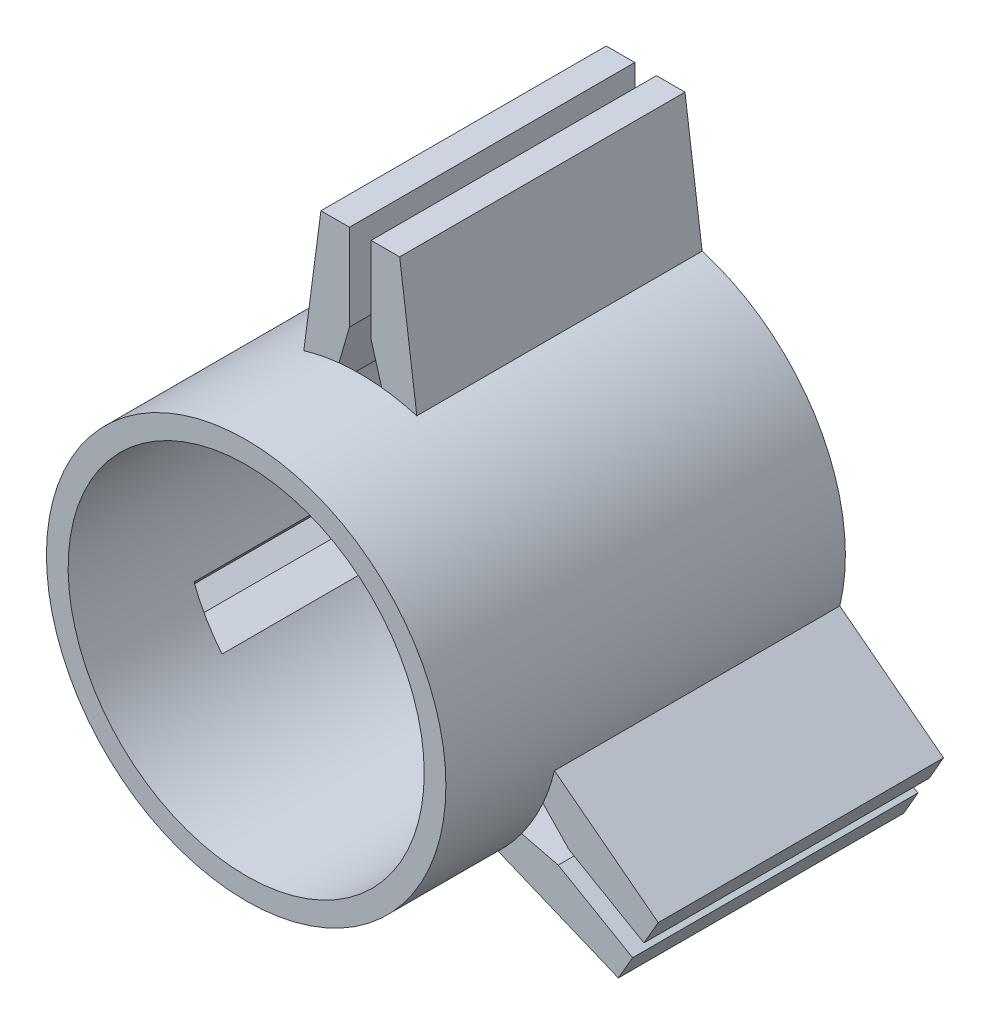
from build123d import *
from build123d.topology import SkipClean

# Parameters (mm, degrees)
SKETCH1_R           = 44.45
SKETCH1_R_2         = 39.624
BOSS_EXTRUDE1_DEPTH = 25.4
BOSS_EXTRUDE2_START = 63.5
SKETCH2_R           = 39.624
BOSS_EXTRUDE2_DEPTH = 63.5
CUT_EXTRUDE1_DEPTH  = 63.5
BOSS_EXTRUDE3_DEPTH = 63.5


with BuildPart() as part:
    # Sketch1 → Boss-Extrude1 (new body)
    with BuildSketch(Plane.XY):
        Circle(SKETCH1_R)
        Circle(SKETCH1_R_2, mode=Mode.SUBTRACT)
    extrude(amount=BOSS_EXTRUDE1_DEPTH)

    # Sketch2 → Boss-Extrude2 (add)
    with SkipClean():  # the faces are left unmerged after this step: merging them gives an invalid solid
        with BuildSketch(Plane(origin=(0, 0, 0), x_dir=(-1, 0, 0), z_dir=(0, 0, -1)).offset(BOSS_EXTRUDE2_START)):
            with BuildLine():
                ThreePointArc((37.231566396, -24.28194728), (38.494829198, -22.225), (39.644566396, -20.102508681))
                Line((39.644566396, -20.102508681), (63.01819717, -33.597280701))
                Line((63.01819717, -33.597280701), (66.19319717, -28.098019387))
                Line((66.19319717, -28.098019387), (42.120859404, -14.199848698))
                ThreePointArc((42.120859404, -14.199848698), (38.494829198, 22.225), (8.763, 43.577658622))
                Line((8.763, 43.577658622), (8.763, 71.501))
                Line((8.763, 71.501), (2.413, 71.501))
                Line((2.413, 71.501), (2.413, 44.384455962))
                ThreePointArc((2.413, 44.384455962), (0, 44.45), (-2.413, 44.384455962))
                Line((-2.413, 44.384455962), (-2.413, 71.374))
                Line((-2.413, 71.374), (-8.763, 71.374))
                Line((-8.763, 71.374), (-8.763, 43.577658622))
                ThreePointArc((-8.763, 43.577658622), (-38.494829198, 22.225), (-42.120859404, -14.199848698))
                Line((-42.120859404, -14.199848698), (-66.303182396, -28.161519387))
                Line((-66.303182396, -28.161519387), (-63.128182396, -33.660780701))
                Line((-63.128182396, -33.660780701), (-39.644566396, -20.102508681))
                ThreePointArc((-39.644566396, -20.102508681), (-38.494829198, -22.225), (-37.231566396, -24.28194728))
                Line((-37.231566396, -24.28194728), (-60.60519717, -37.776719299))
                Line((-60.60519717, -37.776719299), (-57.43019717, -43.275980613))
                Line((-57.43019717, -43.275980613), (-33.357859404, -29.377809925))
                ThreePointArc((-33.357859404, -29.377809925), (0, -44.45), (33.357859404, -29.377809925))
                Line((33.357859404, -29.377809925), (57.540182396, -43.339480613))
                Line((57.540182396, -43.339480613), (60.715182396, -37.840219299))
                Line((60.715182396, -37.840219299), (37.231566396, -24.28194728))
            make_face()
            Circle(SKETCH2_R, mode=Mode.SUBTRACT)
        extrude(amount=-BOSS_EXTRUDE2_DEPTH)

    # Sketch3 → Cut-Extrude1 (cut)
    with SkipClean():  # the faces are left unmerged after this step: merging them gives an invalid solid
        with BuildSketch(Plane(origin=(0, 0, -63.5), x_dir=(-1, 0, 0), z_dir=(0, 0, -1))):
            with BuildLine():
                Line((-2.413, 52.250458999), (-2.413, 44.384455962))
                ThreePointArc((-2.413, 44.384455962), (0, 44.45), (2.413, 44.384455962))
                Line((2.413, 44.384455962), (2.413, 52.250458999))
                Line((2.413, 52.250458999), (6.223, 39.132283948))
                ThreePointArc((6.223, 39.132283948), (0, 39.624), (-6.223, 39.132283948))
                Line((-6.223, 39.132283948), (-2.413, 52.250458999))
            make_face()
            with BuildLine():
                Line((46.456724852, -24.0355102), (37.001052007, -14.176865886))
                ThreePointArc((37.001052007, -14.176865886), (34.3153906, -19.812), (30.778052007, -24.955418062))
                Line((30.778052007, -24.955418062), (44.043724852, -28.214948799))
                Line((44.043724852, -28.214948799), (37.231566396, -24.28194728))
                ThreePointArc((37.231566396, -24.28194728), (38.494829198, -22.225), (39.644566396, -20.102508681))
                Line((39.644566396, -20.102508681), (46.456724852, -24.0355102))
            make_face()
            with BuildLine():
                Line((-44.043724852, -28.214948799), (-30.778052007, -24.955418062))
                ThreePointArc((-30.778052007, -24.955418062), (-34.3153906, -19.812), (-37.001052007, -14.176865886))
                Line((-37.001052007, -14.176865886), (-46.456724852, -24.0355102))
                Line((-46.456724852, -24.0355102), (-39.644566396, -20.102508681))
                ThreePointArc((-39.644566396, -20.102508681), (-38.494829198, -22.225), (-37.231566396, -24.28194728))
                Line((-37.231566396, -24.28194728), (-44.043724852, -28.214948799))
            make_face()
        extrude(amount=-CUT_EXTRUDE1_DEPTH, mode=Mode.SUBTRACT)

    # Sketch4 → Boss-Extrude3 (add)
    with SkipClean():  # the faces are left unmerged after this step: merging them gives an invalid solid
        with BuildSketch(Plane(origin=(0, 0, -63.5), x_dir=(-1, 0, 0), z_dir=(0, 0, -1))):
            with BuildLine():
                Line((-66.303182396, -28.161519387), (-43.20927926, -10.428839143))
                ThreePointArc((-43.20927926, -10.428839143), (-42.706712228, -12.326363236), (-42.120859404, -14.199848698))
                Line((-42.120859404, -14.199848698), (-66.303182396, -28.161519387))
            make_face()
            with BuildLine():
                Line((-57.43019717, -43.275980613), (-30.63627926, -32.205913947))
                ThreePointArc((-30.63627926, -32.205913947), (-32.028299813, -30.821916084), (-33.357859404, -29.377809925))
                Line((-33.357859404, -29.377809925), (-57.43019717, -43.275980613))
            make_face()
            with BuildLine():
                Line((8.763, 71.501), (12.573, 42.634753089))
                ThreePointArc((12.573, 42.634753089), (10.678412415, 43.14827932), (8.763, 43.577658622))
                Line((8.763, 43.577658622), (8.763, 71.501))
            make_face()
            with BuildLine():
                Line((-8.763, 71.374), (-8.763, 43.577658622))
                ThreePointArc((-8.763, 43.577658622), (-10.678412415, 43.14827932), (-12.573, 42.634753089))
                Line((-12.573, 42.634753089), (-8.763, 71.374))
            make_face()
            with BuildLine():
                Line((57.540182396, -43.339480613), (30.63627926, -32.205913947))
                ThreePointArc((30.63627926, -32.205913947), (32.028299813, -30.821916084), (33.357859404, -29.377809925))
                Line((33.357859404, -29.377809925), (57.540182396, -43.339480613))
            make_face()
            with BuildLine():
                Line((66.19319717, -28.098019387), (42.120859404, -14.199848698))
                ThreePointArc((42.120859404, -14.199848698), (42.706712228, -12.326363236), (43.20927926, -10.428839143))
                Line((43.20927926, -10.428839143), (66.19319717, -28.098019387))
            make_face()
        extrude(amount=-BOSS_EXTRUDE3_DEPTH)


solid = part.part
